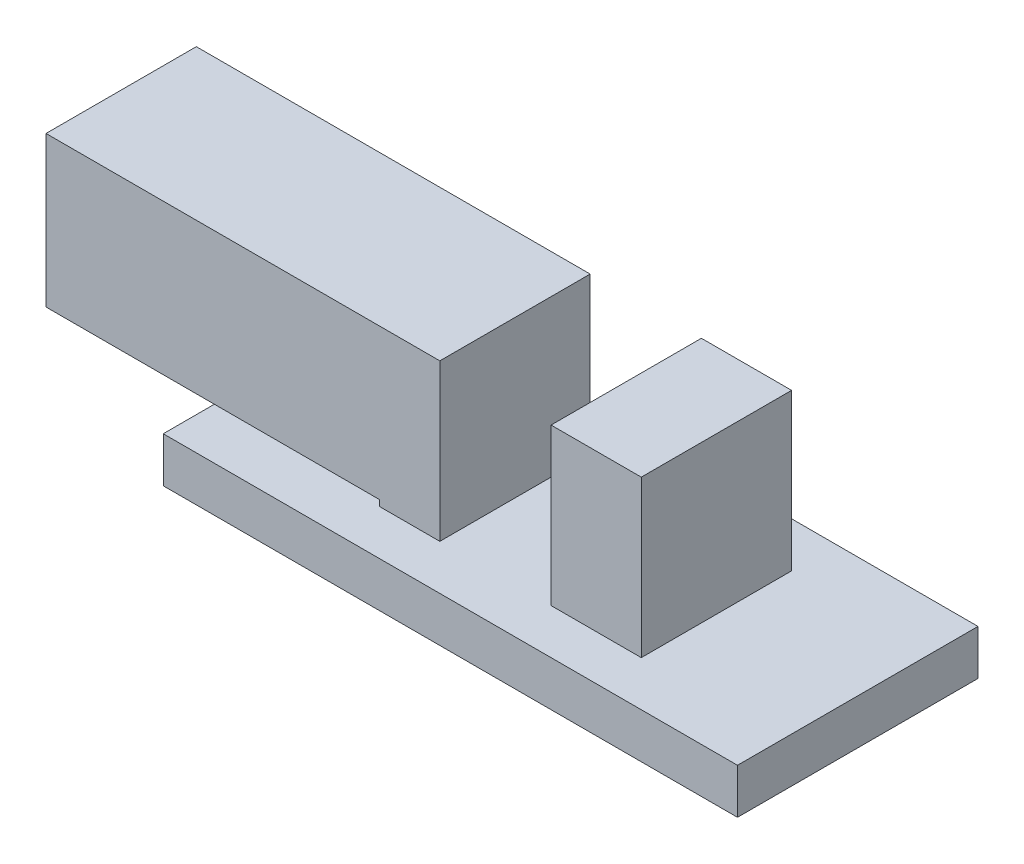
from build123d import *

# Parameters (mm, degrees)
SKETCH1_W           = 191
SKETCH1_H           = 80
BOSS_EXTRUDE1_DEPTH = 15
SKETCH2_W           = 20
SKETCH2_H           = 50
SKETCH2_W_2         = 30
BOSS_EXTRUDE2_DEPTH = 52
SKETCH3_W           = 50
SKETCH3_H           = 50
BOSS_EXTRUDE3_DEPTH = 111


with BuildPart() as part:
    # Sketch1 → Boss-Extrude1 (new body)
    with BuildSketch(Plane(origin=(0, 0, 0), x_dir=(1, 0, 0), z_dir=(0, 1, 0))):
        Rectangle(SKETCH1_W, SKETCH1_H)
    extrude(amount=BOSS_EXTRUDE1_DEPTH)

    # Sketch2 → Boss-Extrude2 (add)
    with BuildSketch(Plane(origin=(0, 15, 0), x_dir=(1, 0, 0), z_dir=(0, 1, 0))):
        with Locations((-28.5, 0)):
            Rectangle(SKETCH2_W, SKETCH2_H)
        with Locations((33.5, 0)):
            Rectangle(SKETCH2_W_2, SKETCH2_H)
    extrude(amount=BOSS_EXTRUDE2_DEPTH)

    # Sketch3 → Boss-Extrude3 (add)
    with BuildSketch(Plane(origin=(-38.5, 0, 0), x_dir=(0, 0, -1), z_dir=(1, 0, 0))):
        with Locations((0, 42)):
            Rectangle(SKETCH3_W, SKETCH3_H)
    extrude(amount=-BOSS_EXTRUDE3_DEPTH)


solid = part.part
